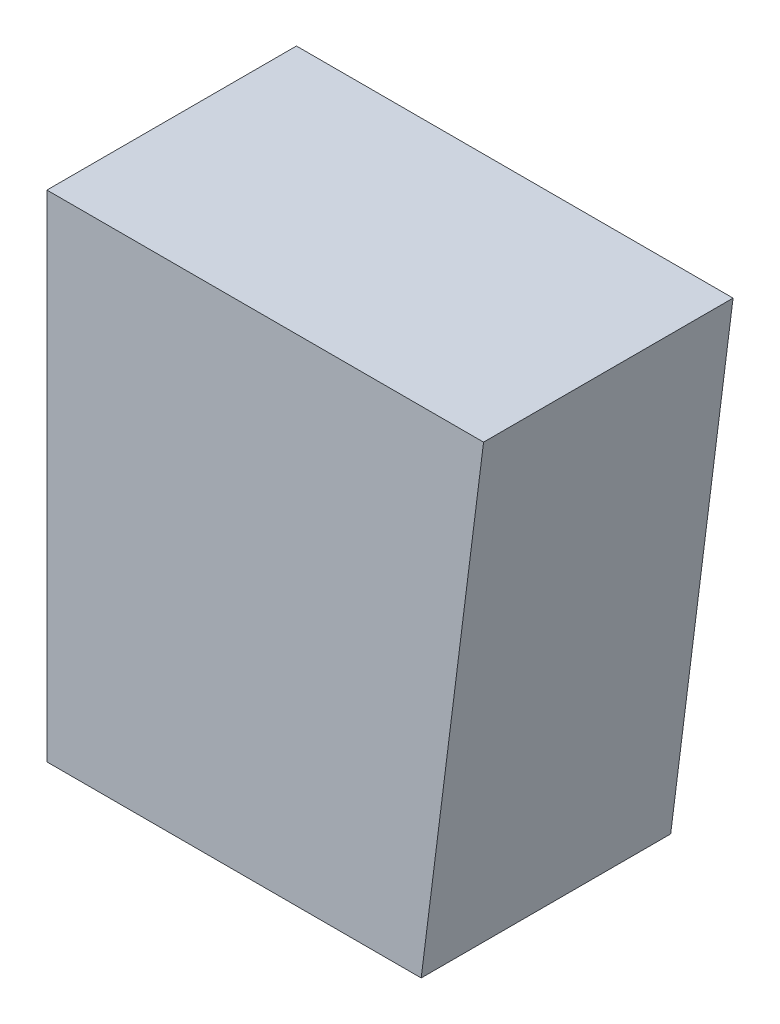
from build123d import *

# Parameters (mm, degrees)
BOSS_EXTRUDE1_DEPTH = 5.08


with BuildPart() as part:
    # Sketch1 → Boss-Extrude1 (new body)
    with BuildSketch(Plane.XY):
        Polygon((0, 0), (7.62, 0), (8.89, 10.0838), (0, 10.0838), align=None)
    extrude(amount=BOSS_EXTRUDE1_DEPTH)


solid = part.part
